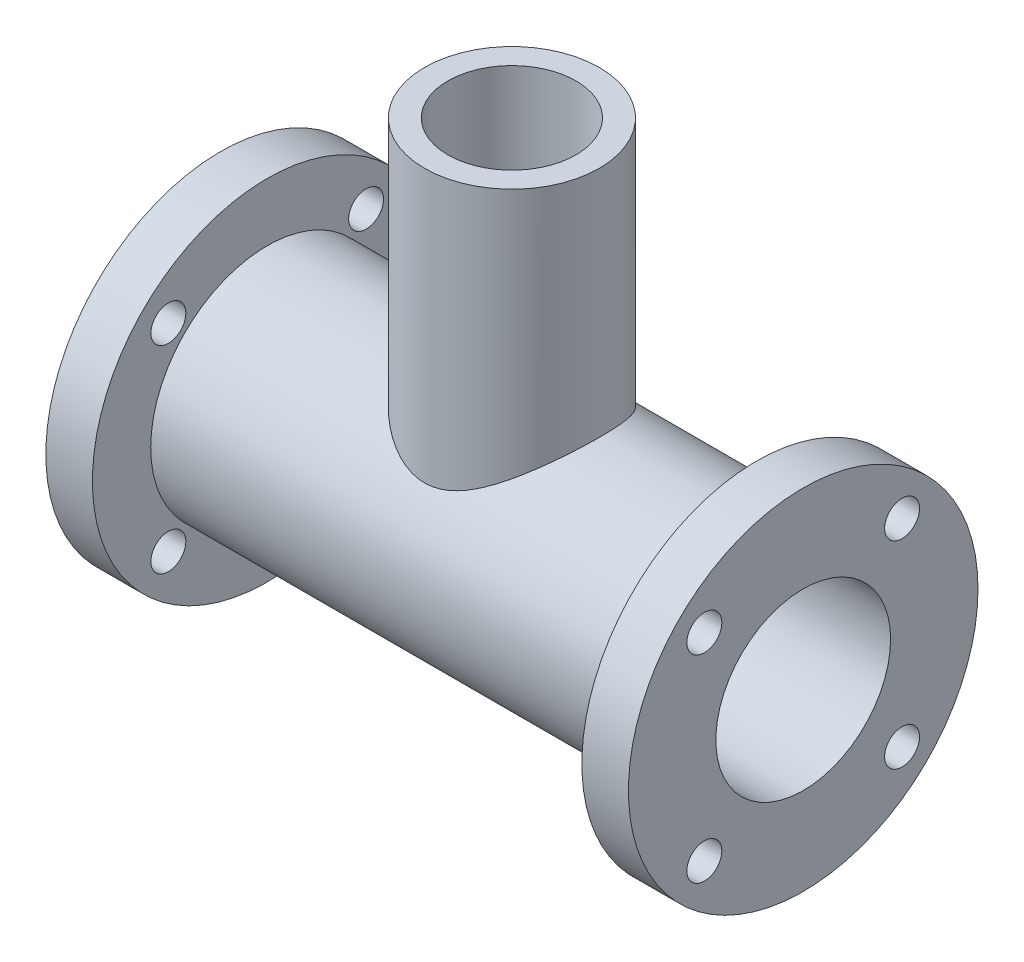
from build123d import *

# Parameters (mm, degrees)
SKETCH_1_R          = 20
EXTRUDE_1_DEPTH     = 100
SKETCH_2_R          = 30
EXTRUDE_2_DEPTH     = 8
SKETCH_3_R          = 30
EXTRUDE_3_DEPTH     = 8
SKETCH_4_R          = 15
EXTRUDE_4_DEPTH     = 60
SKETCH_5_R          = 15
CUT_EXTRUDE_1_DEPTH = 121.415945838
SKETCH_7_R          = 11
CUT_EXTRUDE_3_DEPTH = 60
SKETCH_8_R          = 3
CUT_EXTRUDE_4_DEPTH = 8
CUT_EXTRUDE_START   = -8
SKETCH_9_R          = 3
CUT_EXTRUDE_5_DEPTH = 8


with BuildPart() as part:
    # 草图1 → 凸台-拉伸1 (new body)
    with BuildSketch(Plane(origin=(-50, 0, 0), x_dir=(0, 0, -1), z_dir=(1, 0, 0))):
        Circle(SKETCH_1_R)
    extrude(amount=EXTRUDE_1_DEPTH)

    # 草图2 → 凸台-拉伸2 (add)
    with BuildSketch(Plane(origin=(-50, 0, 0), x_dir=(0, 0, -1), z_dir=(1, 0, 0))):
        Circle(SKETCH_2_R)
    extrude(amount=EXTRUDE_2_DEPTH)

    # 草图3 → 凸台-拉伸3 (add)
    with BuildSketch(Plane(origin=(42, 0, 0), x_dir=(0, 0, -1), z_dir=(1, 0, 0))):
        Circle(SKETCH_3_R)
    extrude(amount=EXTRUDE_3_DEPTH)

    # 草图4 → 凸台-拉伸4 (add)
    with BuildSketch(Plane(origin=(0, 0, 0), x_dir=(1, 0, 0), z_dir=(0, 1, 0))):
        with Locations(Location((0, 0, 0), (0, 0, 90))):
            Circle(SKETCH_4_R)
    extrude(amount=EXTRUDE_4_DEPTH)

    # 草图5 → 切除-拉伸1 (cut, through all)
    with BuildSketch(Plane(origin=(-50, 0, 0), x_dir=(0, 0, -1), z_dir=(1, 0, 0))):
        Circle(SKETCH_5_R)
    extrude(amount=CUT_EXTRUDE_1_DEPTH, mode=Mode.SUBTRACT)

    # 草图7 → 切除-拉伸3 (cut)
    with BuildSketch(Plane(origin=(0, 60, 0), x_dir=(1, 0, 0), z_dir=(0, 1, 0))):
        with Locations(Location((0, 0, 0), (0, 0, 270))):
            Circle(SKETCH_7_R)
    extrude(amount=-CUT_EXTRUDE_3_DEPTH, mode=Mode.SUBTRACT)

    # 草图8 → 切除-拉伸4 (cut)
    with BuildSketch(Plane(origin=(-50, 0, 0), x_dir=(0, 0, -1), z_dir=(1, 0, 0))):
        with Locations((-16.970563, 16.970563)):
            Circle(SKETCH_8_R)
        with Locations((16.970563, 16.970563)):
            Circle(SKETCH_8_R)
        with Locations((16.970563, -16.970563)):
            Circle(SKETCH_8_R)
        with Locations((-16.970563, -16.970563)):
            Circle(SKETCH_8_R)
    extrude(amount=CUT_EXTRUDE_4_DEPTH, mode=Mode.SUBTRACT)

    # 草图9 → 切除-拉伸5 (cut)
    with BuildSketch(Plane(origin=(50, 0, 0), x_dir=(0, 0, -1), z_dir=(1, 0, 0)).offset(CUT_EXTRUDE_START)):
        with Locations((-16.970563, 16.970563)):
            Circle(SKETCH_9_R)
        with Locations((16.970563, 16.970563)):
            Circle(SKETCH_9_R)
        with Locations((16.970563, -16.970563)):
            Circle(SKETCH_9_R)
        with Locations((-16.970563, -16.970563)):
            Circle(SKETCH_9_R)
    extrude(amount=CUT_EXTRUDE_5_DEPTH, mode=Mode.SUBTRACT)


solid = part.part
